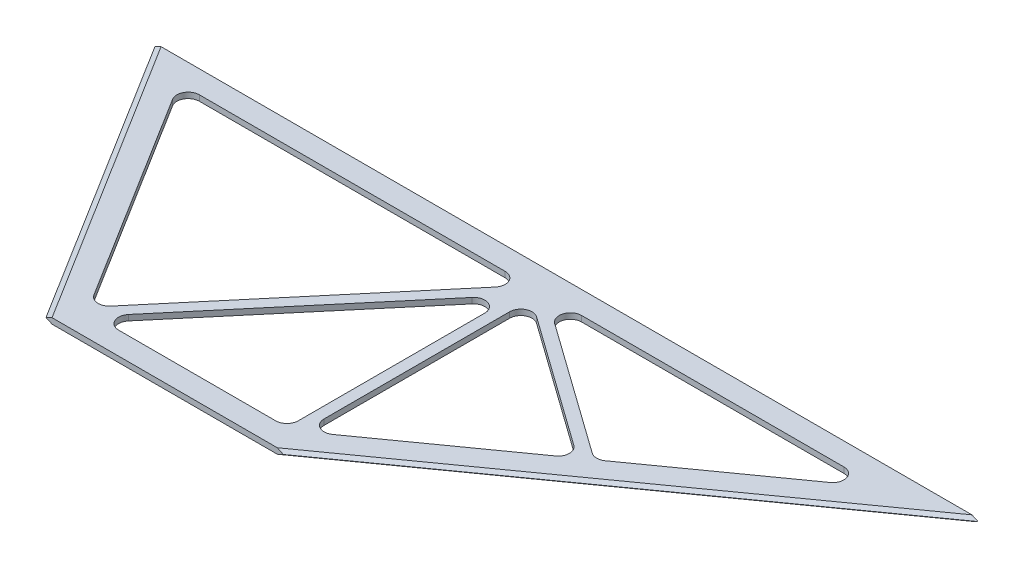
from build123d import *

# Parameters (mm, degrees)
BOSS_EXTRUDE1_DEPTH      = 1.5875
BOSS_EXTRUDE1_DEPTH_BACK = 1.5875
CUT_EXTRUDE2_DEPTH       = 284.597068155
BOSS_EXTRUDE2_DEPTH      = 3.175
FILLET1_R                = 6.35
FILLET2_R                = 6.35


with BuildPart() as part:
    # CS path → Boss-Extrude1 (new, two sides: drawn at the far end of the back side and taken through both)
    with BuildSketch(Plane(origin=(0, 0, 0), x_dir=(1, 0, 0), z_dir=(0, 1, 0)).offset(-BOSS_EXTRUDE1_DEPTH_BACK)):
        Polygon((-228.6, 0), (228.6, 0), (0, -163.068), (-127, -163.068), align=None)
    extrude(amount=BOSS_EXTRUDE1_DEPTH + BOSS_EXTRUDE1_DEPTH_BACK)

    # Sweep1: sweep along a curve in space
    with BuildLine() as sweep1_path:
        Line((-228.6, 1.5875, 0), (-127, 1.5875, 163.068))
    # Sketch10 → Sweep1 (sweep)
    with BuildSketch(Plane.XY.offset(163.068)):
        Polygon((-127, 1.5875), (-130.404404736, 0), (-127, -1.5875), align=None)
    sweep(path=sweep1_path.line)

    # Sweep2: sweep along a curve in space
    with BuildLine() as sweep2_path:
        Line((0, 1.5875, 163.068), (228.6, 1.5875, 0))
    # Sketch11 → Sweep2 (sweep)
    with BuildSketch(Plane.XY.offset(163.068)):
        Polygon((0, 1.5875), (3.404404736, 0), (0, -1.5875), align=None)
    sweep(path=sweep2_path.line)

    # Sketch2 → Cut-Extrude2 (cut, through all)
    with BuildSketch(Plane(origin=(0, 1.5875, 0), x_dir=(1, 0, 0), z_dir=(0, 1, 0))):
        Polygon((-205.723873178, -12.7), (188.927034488, -12.7), (-4.065488877, -150.368), (-119.94941835, -150.368), align=None)
    extrude(amount=-CUT_EXTRUDE2_DEPTH, mode=Mode.SUBTRACT)

    # Sketch3 → Boss-Extrude2 (add)
    with BuildSketch(Plane(origin=(0, 1.5875, 0), x_dir=(1, 0, 0), z_dir=(0, 1, 0))):
        Polygon((-8.215599111, -12.7), (-121.714648415, -147.534805746), (-119.94941835, -150.368), (-115.799308116, -150.368), (-7.240488877, -21.402097696), (-7.240488877, -150.368), (-4.065488877, -150.368), (-0.890488877, -148.103166667), (-0.890488877, -18.864845516), (89.697119406, -83.484006092), (95.164426205, -79.583993908), (1.401817922, -12.7), align=None)
    extrude(amount=-BOSS_EXTRUDE2_DEPTH)

    # Fillet1
    fillet1_edges = [part.edges().sort_by_distance(p)[0] for p in [
        (95.164426205, 0, 79.583993908),
        (-121.714648415, 0, 147.534805746),
        (-115.799308116, 0, 150.368),
        (-7.240488877, 0, 150.368),
        (-0.890488877, 0, 148.103166667),
        (89.697119406, 0, 83.484006092),
        (1.401817922, 0, 12.7),
        (-8.215599111, 0, 12.7),
        (-7.240488877, 0, 21.402097696),
        (-0.890488877, 0, 18.864845516),
    ]]
    fillet(fillet1_edges, radius=FILLET1_R)

    # Fillet2
    fillet2_edges = [part.edges().sort_by_distance(p)[0] for p in [
        (188.927034488, 0, 12.7),
        (-205.723873178, 0, 12.7),
    ]]
    fillet(fillet2_edges, radius=FILLET2_R)


solid = part.part
